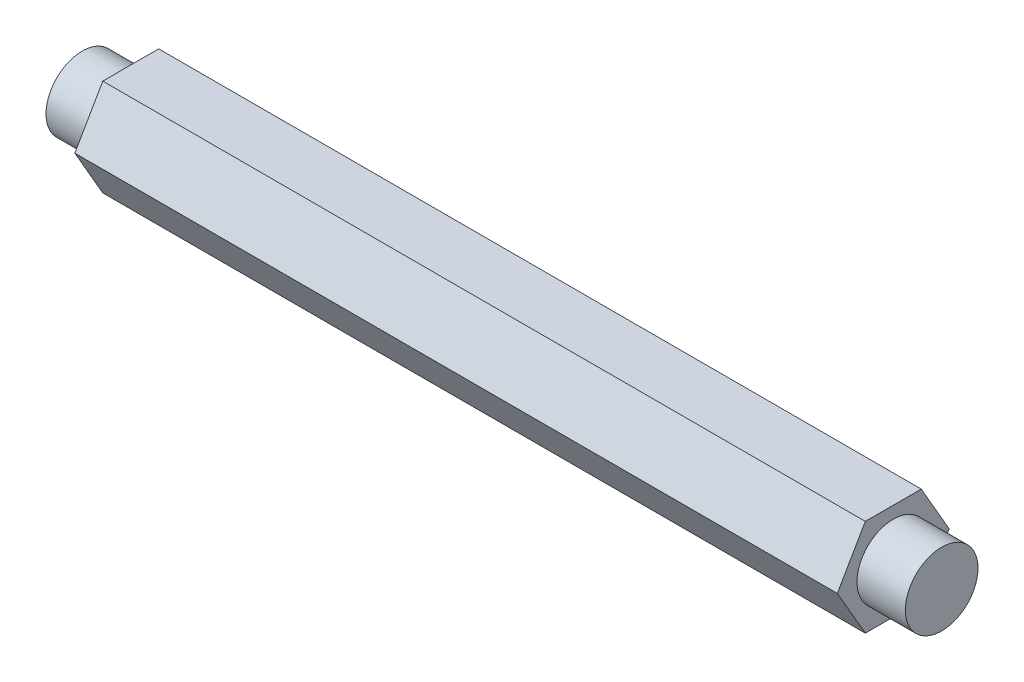
from build123d import *

# Parameters (mm, degrees)
SALIENTE_EXTRUIR1_DEPTH = 112.7
CROQUIS2_R              = 7.332348419
CROQUIS2_R_2            = 4.7625
CORTAR_EXTRUIR1_DEPTH   = 6.35
CORTAR_EXTRUIR2_START   = -6.35
CROQUIS3_R              = 7.332348419
CROQUIS3_R_2            = 4.7625
CORTAR_EXTRUIR2_DEPTH   = 6.35


with BuildPart() as part:
    # Croquis1 → Saliente-Extruir1 (new body)
    with BuildSketch(Plane(origin=(0, 0, 0), x_dir=(0, 0, -1), z_dir=(1, 0, 0))):
        Polygon((7.332348419, 0), (3.666174209, 6.35), (-3.666174209, 6.35), (-7.332348419, 0), (-3.666174209, -6.35), (3.666174209, -6.35), align=None)
    extrude(amount=SALIENTE_EXTRUIR1_DEPTH)

    # Croquis2 → Cortar-Extruir1 (cut)
    with BuildSketch(Plane(origin=(112.7, 0, 0), x_dir=(0, 0, -1), z_dir=(1, 0, 0))):
        Circle(CROQUIS2_R)
        Circle(CROQUIS2_R_2, mode=Mode.SUBTRACT)
    extrude(amount=-CORTAR_EXTRUIR1_DEPTH, mode=Mode.SUBTRACT)

    # Croquis3 → Cortar-Extruir2 (cut)
    with BuildSketch(Plane.ZY.offset(CORTAR_EXTRUIR2_START)):
        Circle(CROQUIS3_R)
        with Locations(Location((0, 0, 0), (0, 0, 180))):
            Circle(CROQUIS3_R_2, mode=Mode.SUBTRACT)
    extrude(amount=CORTAR_EXTRUIR2_DEPTH, mode=Mode.SUBTRACT)


solid = part.part
